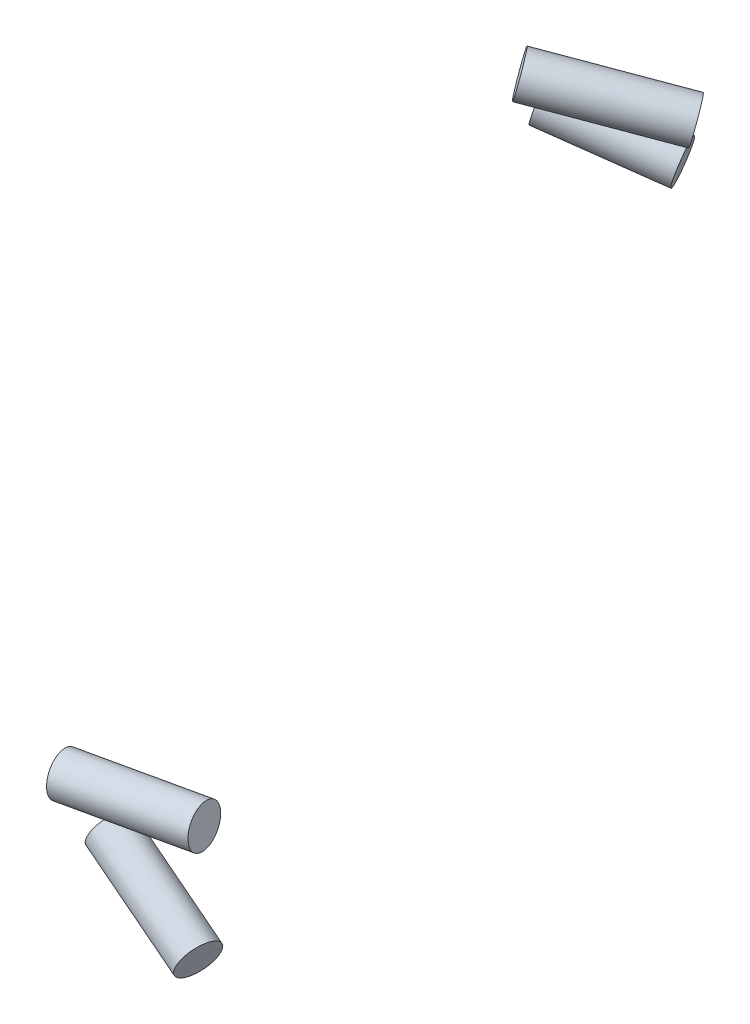
from build123d import *

# Parameters (mm, degrees)
SUSP_RL_ROCKER_BRACKET_A_PROFILE_R   = 7
SUSP_RL_ROCKER_BRACKET_B_PROFILE_R   = 7
SUSP_RL_COILOVER_BRACKET_A_PROFILE_R = 7
SUSP_RL_COILOVER_BRACKET_B_PROFILE_R = 7


with BuildPart() as part:
    # SUSP_RL_rocker_bracket_a: sweep along a curve in space
    with BuildLine() as susp_rl_rocker_bracket_a_path:
        Line((-231.564969, 1104.02989, -80.5982665), (-268.814973, 1120.8704, -87.4287982))
    # SUSP_RL_rocker_bracket_a profile (on start of the path) → SUSP_RL_rocker_bracket_a (sweep)
    with BuildSketch(Plane(origin=(-231.564969, 1104.02989, -80.5982665), x_dir=(-0.41195094092127316, -0.9112060262498695, 0), z_dir=(-0.8987466334179565, 0.4063181219401058, -0.16480313317092873))):
        Circle(SUSP_RL_ROCKER_BRACKET_A_PROFILE_R)
    sweep(path=susp_rl_rocker_bracket_a_path.line)


with BuildPart() as body_2:
    # SUSP_RL_rocker_bracket_b: sweep along a curve in space
    with BuildLine() as susp_rl_rocker_bracket_b_path:
        Line((-217.967798, 1156.31916, -69.0971306), (-259.065027, 1155.1096, -61.5712018))
    # SUSP_RL_rocker_bracket_b profile (on start of the path) → SUSP_RL_rocker_bracket_b (sweep)
    with BuildSketch(Plane(origin=(-217.967798, 1156.31916, -69.0971306), x_dir=(-0.18012957419404588, 0, -0.9836428907386419), z_dir=(-0.9832309457336401, -0.028938126770580858, 0.18005413677764104))):
        Circle(SUSP_RL_ROCKER_BRACKET_B_PROFILE_R)
    sweep(path=susp_rl_rocker_bracket_b_path.line)


with BuildPart() as body_3:
    # SUSP_RL_coilover_bracket_a: sweep along a curve in space
    with BuildLine() as susp_rl_coilover_bracket_a_path:
        Line((-243.984676, 1245.82104, -259.67307), (-276.582297, 1256.39216, -243.533226))
    # SUSP_RL_coilover_bracket_a profile (on start of the path) → SUSP_RL_coilover_bracket_a (sweep)
    with BuildSketch(Plane(origin=(-243.984676, 1245.82104, -259.67307), x_dir=(-0.4437139540554131, 0, -0.8961684701977138), z_dir=(-0.8605635597184917, 0.2790731463934563, 0.42608513075052806))):
        Circle(SUSP_RL_COILOVER_BRACKET_A_PROFILE_R)
    sweep(path=susp_rl_coilover_bracket_a_path.line)


with BuildPart() as body_4:
    # SUSP_RL_coilover_bracket_b: sweep along a curve in space
    with BuildLine() as susp_rl_coilover_bracket_b_path:
        Line((-238.279774, 1261.68448, -258.540964), (-272.150503, 1271.95544, -231.779774))
    # SUSP_RL_coilover_bracket_b profile (on start of the path) → SUSP_RL_coilover_bracket_b (sweep)
    with BuildSketch(Plane(origin=(-238.279774, 1261.68448, -258.540964), x_dir=(-0.6199459454957336, 0, -0.7846445212090639), z_dir=(-0.7633345136071678, 0.2314735610172051, 0.6031089544071807))):
        Circle(SUSP_RL_COILOVER_BRACKET_B_PROFILE_R)
    sweep(path=susp_rl_coilover_bracket_b_path.line)


solid = Compound([part.part, body_2.part, body_3.part, body_4.part])
